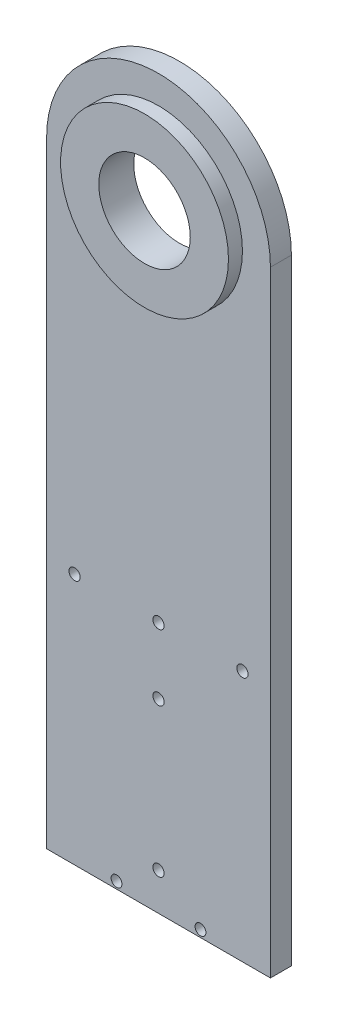
from build123d import *

# Parameters (mm, degrees)
BOSS_EXTRUDE1_DEPTH              = 9.525
SKETCH2_R                        = 38.1
BOSS_EXTRUDE2_DEPTH              = 6.35
SKETCH3_R                        = 20.7645
CUT_EXTRUDE1_DEPTH               = 335.461799949
F_10_0_1935_DIAMETER_HOLE1_D     = 4.9149
F_10_0_1935_DIAMETER_HOLE1_DEPTH = 10.16
F_10_0_1935_DIAMETER_HOLE1_TIP   = 1.476584928
F_10_CLEARANCE_HOLE1_D           = 5.1054


with BuildPart() as part:
    # Sketch1 → Boss-Extrude1 (new body)
    with BuildSketch(Plane.XY):
        with BuildLine():
            Line((-50.8, 0), (50.8, 0))
            Line((50.8, 0), (50.8, 279.4))
            ThreePointArc((50.8, 279.4), (0, 330.2), (-50.8, 279.4))
            Line((-50.8, 279.4), (-50.8, 0))
        make_face()
    extrude(amount=BOSS_EXTRUDE1_DEPTH)

    # Sketch2 → Boss-Extrude2 (add)
    with BuildSketch(Plane.XY.offset(9.525)):
        with Locations((0, 279.4)):
            Circle(SKETCH2_R)
    extrude(amount=BOSS_EXTRUDE2_DEPTH)

    # Sketch3 → Cut-Extrude1 (cut, through all)
    with BuildSketch(Plane.XY.offset(15.875)):
        with Locations((0, 279.4)):
            Circle(SKETCH3_R)
    extrude(amount=-CUT_EXTRUDE1_DEPTH, mode=Mode.SUBTRACT)

    # #10 (0.1935) Diameter Hole1
    with Locations(Plane(origin=(0, 0, 0), x_dir=(-1, 0, 0), z_dir=(0, 0, -1))):
        with Locations((-19.05, 3.175), (19.05, 3.175)):
            Hole(F_10_0_1935_DIAMETER_HOLE1_D / 2, depth=F_10_0_1935_DIAMETER_HOLE1_DEPTH)
            with Locations((0, 0, -(F_10_0_1935_DIAMETER_HOLE1_DEPTH + F_10_0_1935_DIAMETER_HOLE1_TIP / 2))):  # 118° drill point
                Cone(0, F_10_0_1935_DIAMETER_HOLE1_D / 2, F_10_0_1935_DIAMETER_HOLE1_TIP, mode=Mode.SUBTRACT)

    # #10 Clearance Hole1 (through all)
    with Locations(Plane(origin=(0, 0, 0), x_dir=(-1, 0, 0), z_dir=(0, 0, -1))):
        with Locations((0, 84.30006), (0, 16.99006), (-38.1, 114.3), (0, 114.3), (38.1, 114.3)):
            Hole(F_10_CLEARANCE_HOLE1_D / 2)


solid = part.part
